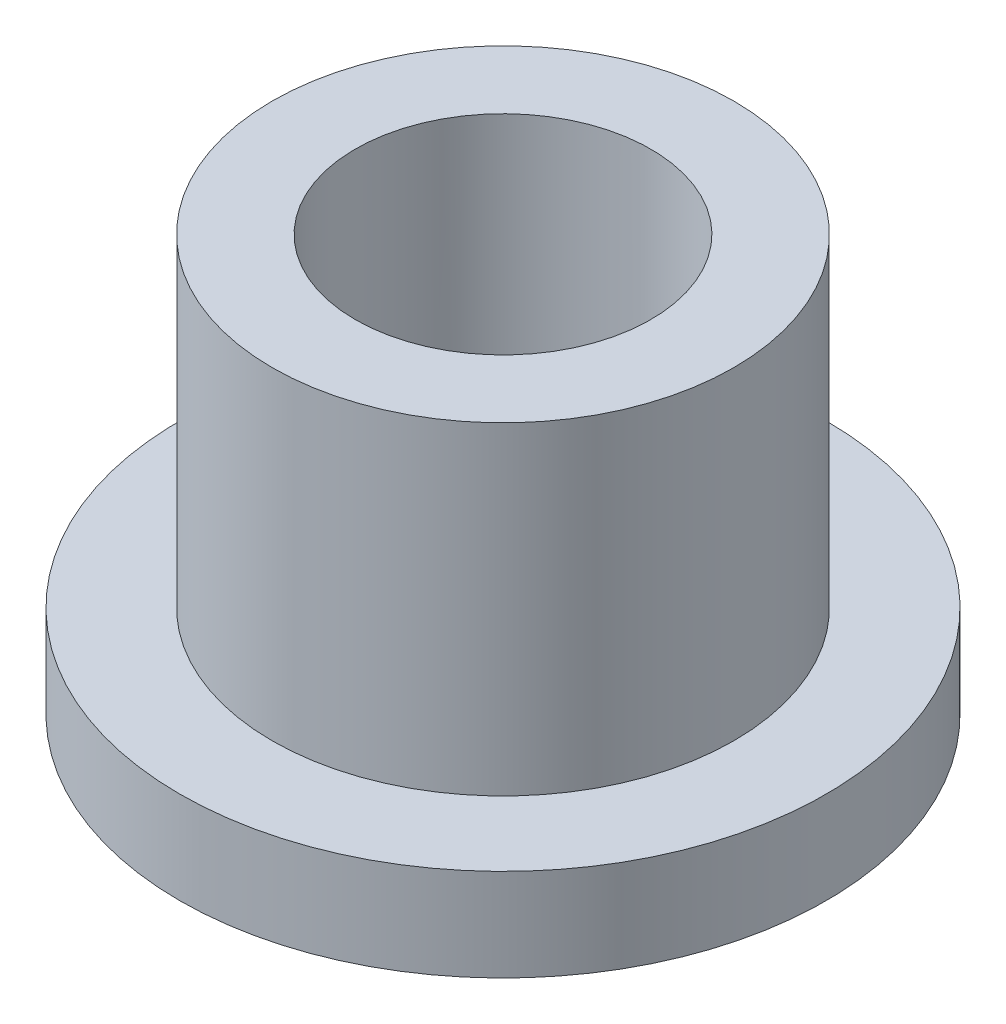
from build123d import *

# Parameters (mm, degrees)
SKETCH3_R          = 2.5
CUT_EXTRUDE1_DEPTH = 0.5


with BuildPart() as part:
    # Sketch2 → Revolve1 (revolve)
    with BuildSketch(Plane.XY, mode=Mode.PRIVATE) as revolve1_sk:
        Polygon((1.6, 0), (1.6, 4.5), (2.5, 4.5), (2.5, 1), (3.5, 1), (3.5, 0), align=None)
    revolve(revolve1_sk.sketch.rotate(Axis((0, -0.92, 0), (0, -1, 0)), 90), axis=Axis((0, -0.92, 0), (0, -1, 0)))

    # Sketch3 → Cut-Extrude1 (cut)
    with BuildSketch(Plane.XZ):
        with Locations(Location((0, 0, 0), (0, 0, 90))):
            Circle(SKETCH3_R)
    extrude(amount=-CUT_EXTRUDE1_DEPTH, mode=Mode.SUBTRACT)


solid = part.part
